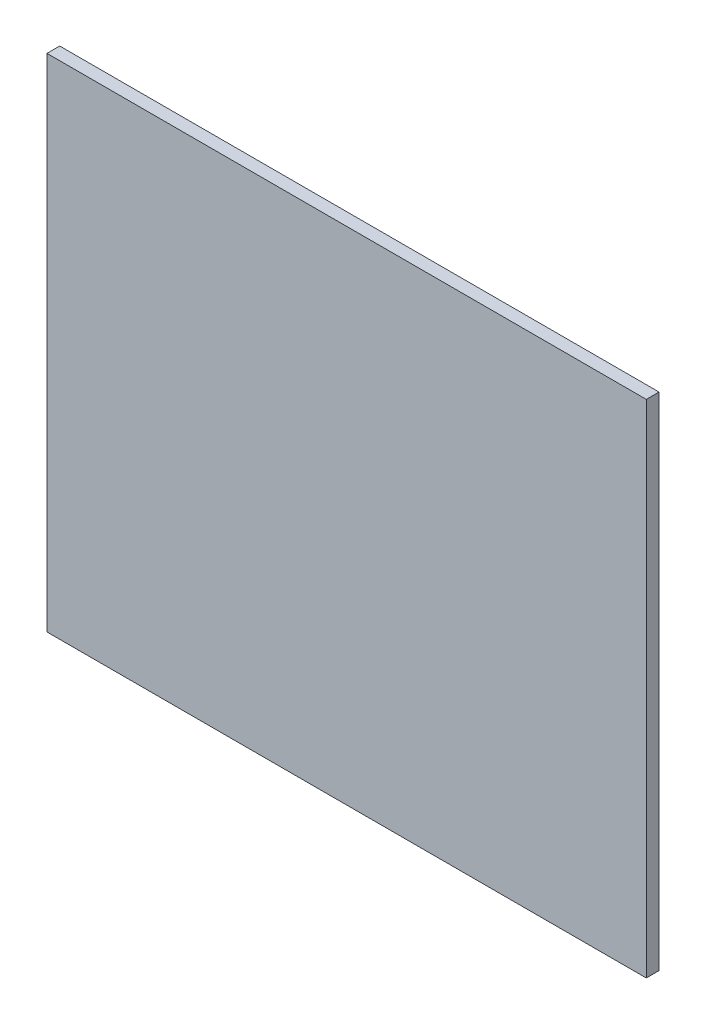
from build123d import *

# Parameters (mm, degrees)
SKIZZE1_W                       = 23.5
SKIZZE1_H                       = 19.65
AUFSATZ_LINEAR_AUSTRAGEN1_DEPTH = 0.5


with BuildPart() as part:
    # Skizze1 → Aufsatz-Linear austragen1 (new body)
    with BuildSketch(Plane.XY):
        with Locations((11.75, 9.825)):
            Rectangle(SKIZZE1_W, SKIZZE1_H)
    extrude(amount=AUFSATZ_LINEAR_AUSTRAGEN1_DEPTH)


solid = part.part
